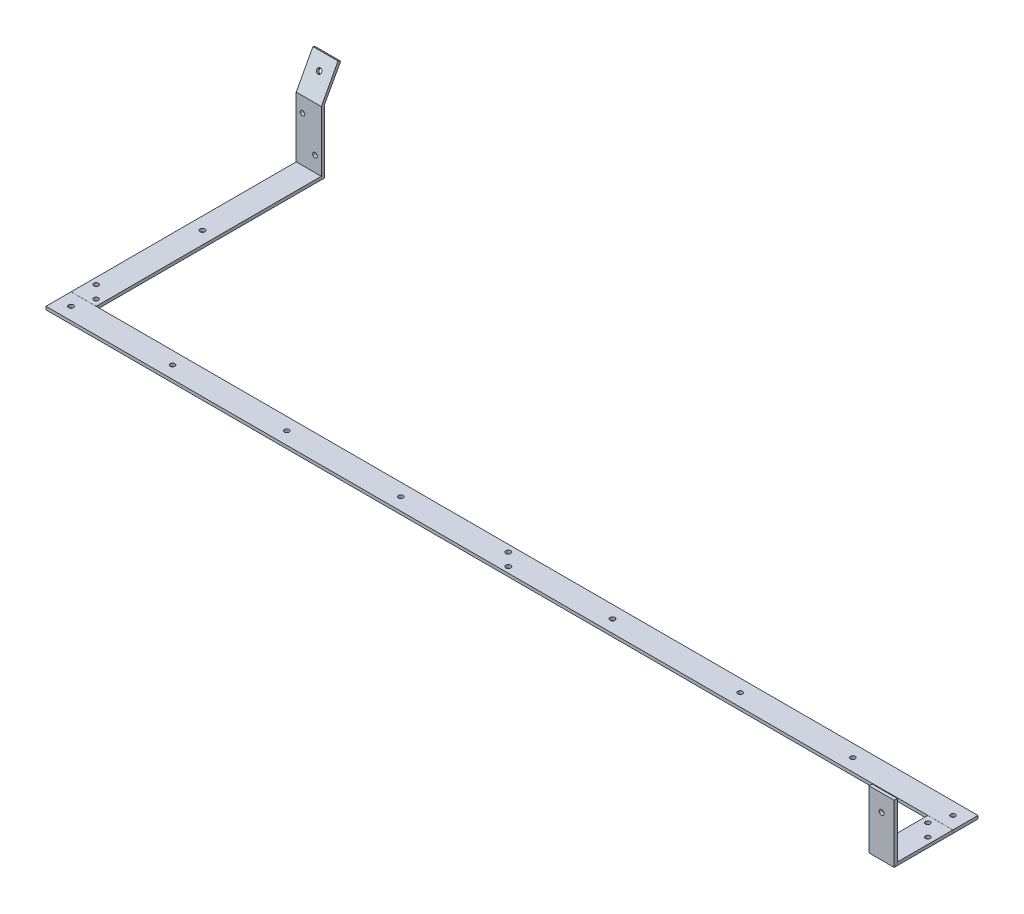
from build123d import *

# Parameters (mm, degrees)
CROQUIS2_W              = 50.8
CROQUIS2_H              = 128.69
SALIENTE_EXTRUIR1_DEPTH = 6.31
CROQUIS3_W              = 50.8
CROQUIS3_H              = 6.31
SALIENTE_EXTRUIR2_DEPTH = 507.13
CROQUIS4_W              = 50.8
CROQUIS4_H              = 6.31
SALIENTE_EXTRUIR3_DEPTH = 1787.3
CROQUIS9_W              = 50.8
CROQUIS9_H              = 6.31
SALIENTE_EXTRUIR4_DEPTH = 98
CROQUIS12_R             = 5
CORTAR_EXTRUIR1_DEPTH   = 10
CORTAR_EXTRUIR2_DEPTH   = 73
CROQUIS16_W             = 47.2
CROQUIS16_H             = 71.54029971
CORTAR_EXTRUIR5_DEPTH   = 10
CROQUIS21_R             = 5
CORTAR_EXTRUIR11_DEPTH  = 10
CROQUIS25_W             = 50.8
CROQUIS25_H             = 0.1
CORTAR_EXTRUIR14_DEPTH  = 50.8
CROQUIS24_W             = 50.8
CROQUIS24_H             = 0.1
CORTAR_EXTRUIR15_DEPTH  = 50.8
CROQUIS26_R             = 4.7625
CORTAR_EXTRUIR16_DEPTH  = 33
CROQUIS27_R             = 5
CORTAR_EXTRUIR17_DEPTH  = 33
CROQUIS28_R             = 5
CORTAR_EXTRUIR18_DEPTH  = 10
CROQUIS29_R             = 4.7625
CORTAR_EXTRUIR19_DEPTH  = 10
CROQUIS30_R             = 4.7625
CORTAR_EXTRUIR20_DEPTH  = 50
CROQUIS31_R             = 5
CORTAR_EXTRUIR21_DEPTH  = 50
CROQUIS32_R             = 5
CORTAR_EXTRUIR22_DEPTH  = 50
CROQUIS33_R             = 5
CORTAR_EXTRUIR23_DEPTH  = 50
CROQUIS34_R             = 4.765
CROQUIS34_R_2           = 4.7625
CORTAR_EXTRUIR24_DEPTH  = 10
CROQUIS35_R             = 4.765
CROQUIS35_R_2           = 4.7625
CORTAR_EXTRUIR25_DEPTH  = 10


with BuildPart() as part:
    # Croquis2 → Saliente-Extruir1 (new body)
    with BuildSketch(Plane.XY):
        Rectangle(CROQUIS2_W, CROQUIS2_H)
    extrude(amount=SALIENTE_EXTRUIR1_DEPTH)

    # Croquis3 → Saliente-Extruir2 (add)
    with BuildSketch(Plane.XY.offset(6.31)):
        with Locations((0, -61.19)):
            Rectangle(CROQUIS3_W, CROQUIS3_H)
    extrude(amount=SALIENTE_EXTRUIR2_DEPTH)

    # Croquis4 → Saliente-Extruir3 (add)
    with BuildSketch(Plane(origin=(25.4, 0, 0), x_dir=(0, 0, -1), z_dir=(1, 0, 0))):
        with Locations((-488.04, -61.19)):
            Rectangle(CROQUIS4_W, CROQUIS4_H)
    extrude(amount=SALIENTE_EXTRUIR3_DEPTH)

    # Barrer2: sweep along a curve in space
    with BuildLine() as barrer2_path:
        Line((1787.3, -61.19, 513.44), (1787.3, -61.19, 629.44))
        Line((1787.3, -61.19, 629.44), (1787.3, 63.52, 629.44))
        Line((1787.3, 63.52, 629.44), (1787.3, 63.52, 1423.44))
    # Croquis9 → Barrer2 (sweep)
    with BuildSketch(Plane.XY.offset(513.44)):
        with Locations((1787.3, -61.19)):
            Rectangle(CROQUIS9_W, CROQUIS9_H)
    sweep(path=barrer2_path.line, transition=Transition.RIGHT)

    # Croquis11 → Saliente-Extruir4 (add)
    with BuildSketch(Plane.ZY.offset(25.4)):
        Polygon((0, 64.345), (-33.068312374, 124.322347428), (-27.542535245, 127.368966394), (6.31, 64.345), align=None)
    extrude(amount=-SALIENTE_EXTRUIR4_DEPTH)

    # Croquis12 → Cortar-Extruir1 (cut)
    with BuildSketch(Plane(origin=(0, 66.675, 0), x_dir=(1, 0, 0), z_dir=(0, 1, 0))):
        with Locations(Location((1787.3, -1390.44, 0), (0, 0, 270))):
            Circle(CROQUIS12_R)
        with Locations(Location((1787.3, -1170.44, 0), (0, 0, 270))):
            Circle(CROQUIS12_R)
    extrude(amount=-CORTAR_EXTRUIR1_DEPTH, mode=Mode.SUBTRACT)

    # Croquis13 → Cortar-Extruir2 (cut)
    with BuildSketch(Plane(origin=(1812.7, 0, 0), x_dir=(0, 0, -1), z_dir=(1, 0, 0))):
        Polygon((-632.595, 53.56128726), (-626.285, 53.56128726), (-626.285, 66.675), (-1423.44, 66.675), (-1423.44, 60.365), (-632.595, 60.365), align=None)
    extrude(amount=-CORTAR_EXTRUIR2_DEPTH, mode=Mode.SUBTRACT)

    # Croquis16 → Cortar-Extruir5 (cut)
    with BuildSketch(Plane(origin=(0, 17.038152429, 31.720281459), x_dir=(1, 0, 0), z_dir=(0, 0.4731953232328629, 0.880957539311939))):
        with Locations((49, 89.469500232)):
            Rectangle(CROQUIS16_W, CROQUIS16_H)
    extrude(amount=-CORTAR_EXTRUIR5_DEPTH, mode=Mode.SUBTRACT)

    # Croquis21 → Cortar-Extruir11 (cut)
    with BuildSketch(Plane(origin=(0, -58.035, 0), x_dir=(1, 0, 0), z_dir=(0, 1, 0))):
        with Locations(Location((0, -221.642204666, 0), (0, 0, 270))):
            Circle(CROQUIS21_R)
    extrude(amount=-CORTAR_EXTRUIR11_DEPTH, mode=Mode.SUBTRACT)

    # Croquis25 → Cortar-Extruir14 (cut)
    with BuildSketch(Plane(origin=(0, -58.035, 0), x_dir=(1, 0, 0), z_dir=(0, 1, 0))):
        with Locations((1787.3, -513.49)):
            Rectangle(CROQUIS25_W, CROQUIS25_H)
    extrude(amount=-CORTAR_EXTRUIR14_DEPTH, mode=Mode.SUBTRACT)


with BuildPart() as cortar_extruir14_piece_1:
    # of the separate pieces the step leaves, piece 1, a body of its own (cortar_extruir14_pieces)
    add(part.part.solids().sort_by_distance((-25.4, -58.035, 6.31))[0])

    # Croquis24 → Cortar-Extruir15 (cut)
    with BuildSketch(Plane(origin=(0, -58.035, 0), x_dir=(1, 0, 0), z_dir=(0, 1, 0))):
        with Locations((0, -462.59)):
            Rectangle(CROQUIS24_W, CROQUIS24_H)
    extrude(amount=-CORTAR_EXTRUIR15_DEPTH, mode=Mode.SUBTRACT)


with BuildPart() as cortar_extruir14_piece_2:
    # of the separate pieces the step leaves, piece 2, a body of its own (cortar_extruir14_pieces)
    add(part.part.solids().sort_by_distance((1812.7, -58.035, 513.54))[0])

    # Croquis27 → Cortar-Extruir17 (cut)
    with BuildSketch(Plane(origin=(0, 0, 626.285), x_dir=(-1, 0, 0), z_dir=(0, 0, -1))):
        with Locations((-1787.3, 19.56128726)):
            Circle(CROQUIS27_R)
    extrude(amount=-CORTAR_EXTRUIR17_DEPTH, mode=Mode.SUBTRACT)

    # Croquis30 → Cortar-Extruir20 (cut)
    with BuildSketch(Plane(origin=(0, -64.345, 0), x_dir=(-1, 0, 0), z_dir=(0, -1, 0))):
        with Locations(Location((-1800, -551.54, 0), (0, 0, 90))):
            Circle(CROQUIS30_R)
        with Locations(Location((-1774.6, -526.14, 0), (0, 0, 90))):
            Circle(CROQUIS30_R)
    extrude(amount=-CORTAR_EXTRUIR20_DEPTH, mode=Mode.SUBTRACT)


with BuildPart() as cortar_extruir15_piece_1:
    # of the separate pieces the step leaves, piece 1, a body of its own (cortar_extruir15_pieces)
    add(cortar_extruir14_piece_1.part.solids().sort_by_distance((-25.4, -58.035, 462.64))[0])

    # Croquis26 → Cortar-Extruir16 (cut)
    with BuildSketch(Plane(origin=(0, -58.035, 0), x_dir=(1, 0, 0), z_dir=(0, 1, 0))):
        with Locations(Location((1787.3, -488.04, 0), (0, 0, 270))):
            Circle(CROQUIS26_R)
    extrude(amount=-CORTAR_EXTRUIR16_DEPTH, mode=Mode.SUBTRACT)

    # Croquis28 → Cortar-Extruir18 (cut)
    with BuildSketch(Plane(origin=(0, -64.345, 0), x_dir=(-1, 0, 0), z_dir=(0, -1, 0))):
        with Locations(Location((-899.999999999, -501.935, 0), (0, 0, 90))):
            Circle(CROQUIS28_R)
        with Locations(Location((-874.599999999, -476.535, 0), (0, 0, 90))):
            Circle(CROQUIS28_R)
    extrude(amount=-CORTAR_EXTRUIR18_DEPTH, mode=Mode.SUBTRACT)

    # Croquis31 → Cortar-Extruir21 (cut)
    with BuildSketch(Plane(origin=(0, -64.345, 0), x_dir=(-1, 0, 0), z_dir=(0, -1, 0))):
        with Locations(Location((-1097.299999999, -488.04, 0), (0, 0, 90))):
            Circle(CROQUIS31_R)
    extrude(amount=-CORTAR_EXTRUIR21_DEPTH, mode=Mode.SUBTRACT)

    # Croquis32 → Cortar-Extruir22 (cut)
    with BuildSketch(Plane(origin=(0, -58.035, 0), x_dir=(1, 0, 0), z_dir=(0, 1, 0))):
        with Locations(Location((0, -488.04, 0), (0, 0, 270))):
            Circle(CROQUIS32_R)
    extrude(amount=-CORTAR_EXTRUIR22_DEPTH, mode=Mode.SUBTRACT)

    # Croquis35 → Cortar-Extruir25 (cut)
    with BuildSketch(Plane(origin=(0, -58.035, 0), x_dir=(1, 0, 0), z_dir=(0, 1, 0))):
        with Locations(Location((1584.418928683, -488.04, 0), (0, 0, 270))):
            Circle(CROQUIS35_R)
        with Locations(Location((1356.137857365, -488.04, 0), (0, 0, 270))):
            Circle(CROQUIS35_R)
        with Locations(Location((668.331786048, -488.04, 0), (0, 0, 270))):
            Circle(CROQUIS35_R)
        with Locations(Location((437.087857365, -488.04, 0), (0, 0, 270))):
            Circle(CROQUIS35_R)
        with Locations(Location((205.843928683, -488.04, 0), (0, 0, 270))):
            Circle(CROQUIS35_R_2)
    extrude(amount=-CORTAR_EXTRUIR25_DEPTH, mode=Mode.SUBTRACT)


with BuildPart() as cortar_extruir15_piece_2:
    # of the separate pieces the step leaves, piece 2, a body of its own (cortar_extruir15_pieces)
    add(cortar_extruir14_piece_1.part.solids().sort_by_distance((-25.4, -58.035, 6.31))[0])

    # Croquis29 → Cortar-Extruir19 (cut)
    with BuildSketch(Plane(origin=(0, -64.345, 0), x_dir=(-1, 0, 0), z_dir=(0, -1, 0))):
        with Locations(Location((12.7, -424.54, 0), (0, 0, 90))):
            Circle(CROQUIS29_R)
        with Locations(Location((-12.7, -449.94, 0), (0, 0, 90))):
            Circle(CROQUIS29_R)
    extrude(amount=-CORTAR_EXTRUIR19_DEPTH, mode=Mode.SUBTRACT)

    # Croquis33 → Cortar-Extruir23 (cut)
    with BuildSketch(Plane(origin=(0, 17.038152429, 31.720281459), x_dir=(1, 0, 0), z_dir=(0, 0.473195323232863, 0.8809575393119389))):
        with Locations(Location((0, 98.119650087, 0), (0, 0, 270))):
            Circle(CROQUIS33_R)
    extrude(amount=-CORTAR_EXTRUIR23_DEPTH, mode=Mode.SUBTRACT)

    # Croquis34 → Cortar-Extruir24 (cut)
    with BuildSketch(Plane.XY.offset(6.31)):
        with Locations((12.7, -27.44)):
            Circle(CROQUIS34_R)
        with Locations((-12.7, 33.75)):
            Circle(CROQUIS34_R_2)
    extrude(amount=-CORTAR_EXTRUIR24_DEPTH, mode=Mode.SUBTRACT)


solid = Compound([cortar_extruir14_piece_2.part, cortar_extruir15_piece_1.part, cortar_extruir15_piece_2.part])
